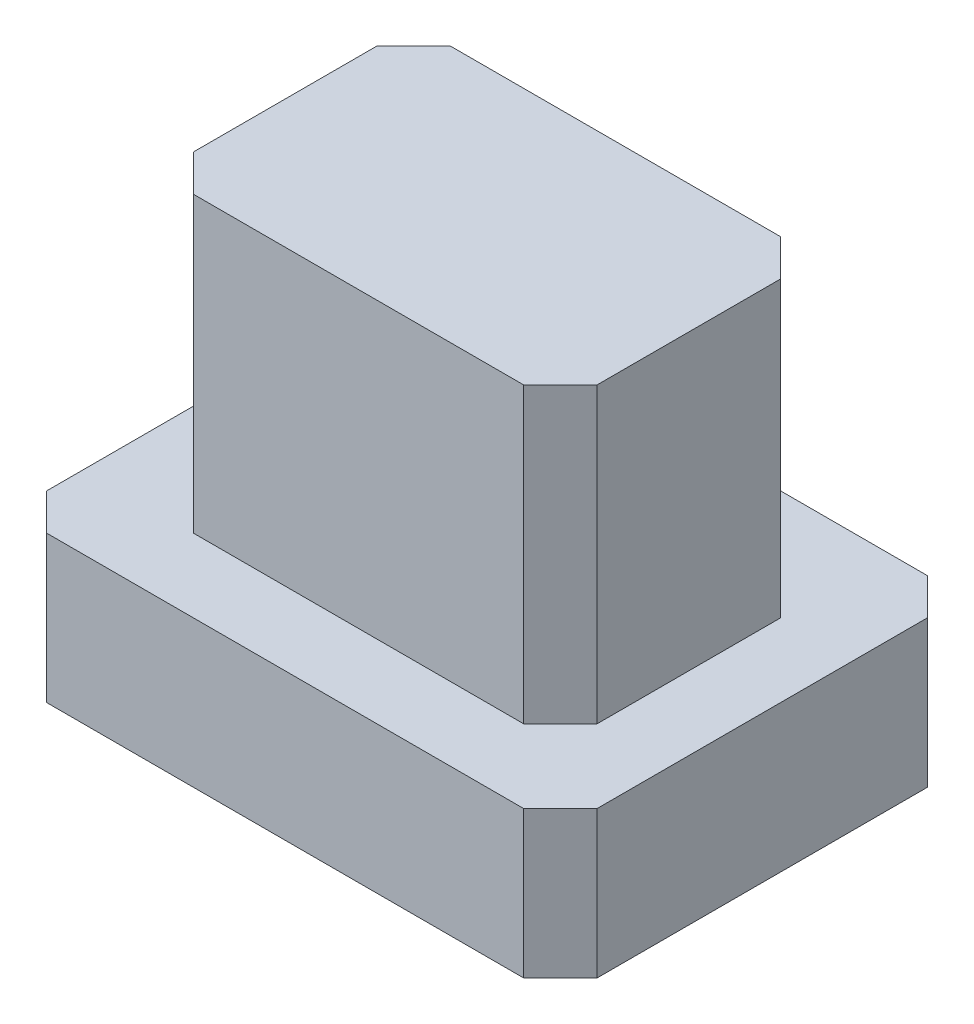
from build123d import *

# Parameters (mm, degrees)
ESQUISSE1_W        = 15
ESQUISSE1_H        = 11
BOSS_EXTRU_1_DEPTH = 4
CHANFREIN1_SIZE    = 1
ESQUISSE2_W        = 11
ESQUISSE2_H        = 7
BOSS_EXTRU_2_DEPTH = 8
CHANFREIN3_SIZE    = 1


with BuildPart() as part:
    # Esquisse1 → Boss.-Extru.1 (new body)
    with BuildSketch(Plane(origin=(0, 0, 0), x_dir=(1, 0, 0), z_dir=(0, 1, 0))):
        Rectangle(ESQUISSE1_W, ESQUISSE1_H)
    extrude(amount=-BOSS_EXTRU_1_DEPTH)

    # Chanfrein1
    chanfrein1_edges = [part.edges().sort_by_distance(p)[0] for p in [
        (7.5, -2, 5.5),
        (-7.5, -2, 5.5),
        (-7.5, -2, -5.5),
        (7.5, -2, -5.5),
    ]]
    chamfer(chanfrein1_edges, length=CHANFREIN1_SIZE)

    # Esquisse2 → Boss.-Extru.2 (add)
    with BuildSketch(Plane(origin=(0, 0, 0), x_dir=(1, 0, 0), z_dir=(0, 1, 0))):
        Rectangle(ESQUISSE2_W, ESQUISSE2_H)
    extrude(amount=BOSS_EXTRU_2_DEPTH)

    # Chanfrein3
    chanfrein3_edges = [part.edges().sort_by_distance(p)[0] for p in [
        (5.5, 4, 3.5),
        (5.5, 4, -3.5),
        (-5.5, 4, -3.5),
        (-5.5, 4, 3.5),
    ]]
    chamfer(chanfrein3_edges, length=CHANFREIN3_SIZE)


solid = part.part
